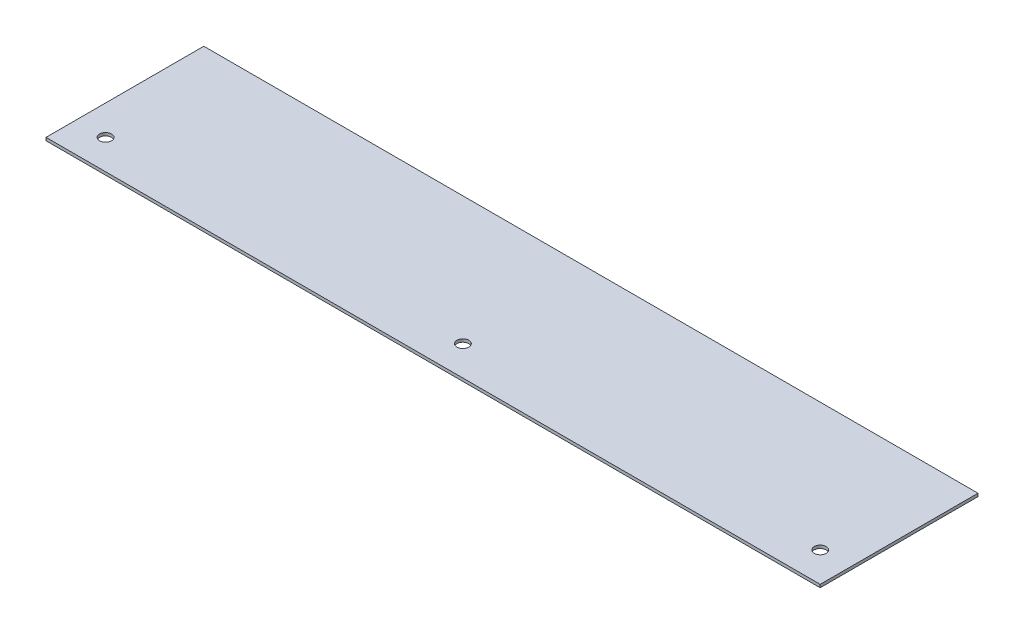
from build123d import *

# Parameters (mm, degrees)
SKETCH1_4_R         = 2
BOSS_EXTRUDE3_DEPTH = 1


with BuildPart() as part:
    # Sketch1<4> → Boss-Extrude3 (new body)
    with BuildSketch(Plane(origin=(0, 0, 0), x_dir=(1, 0, 0), z_dir=(0, 1, 0))):
        Polygon((130, 43), (-130, 43), (-130, 5), (-130, -10), (130, -10), align=None)
        with Locations((-120, 0)):
            Circle(SKETCH1_4_R, mode=Mode.SUBTRACT)
        Circle(SKETCH1_4_R, mode=Mode.SUBTRACT)
        with Locations((120, 0)):
            Circle(SKETCH1_4_R, mode=Mode.SUBTRACT)
    extrude(amount=BOSS_EXTRUDE3_DEPTH)


solid = part.part
